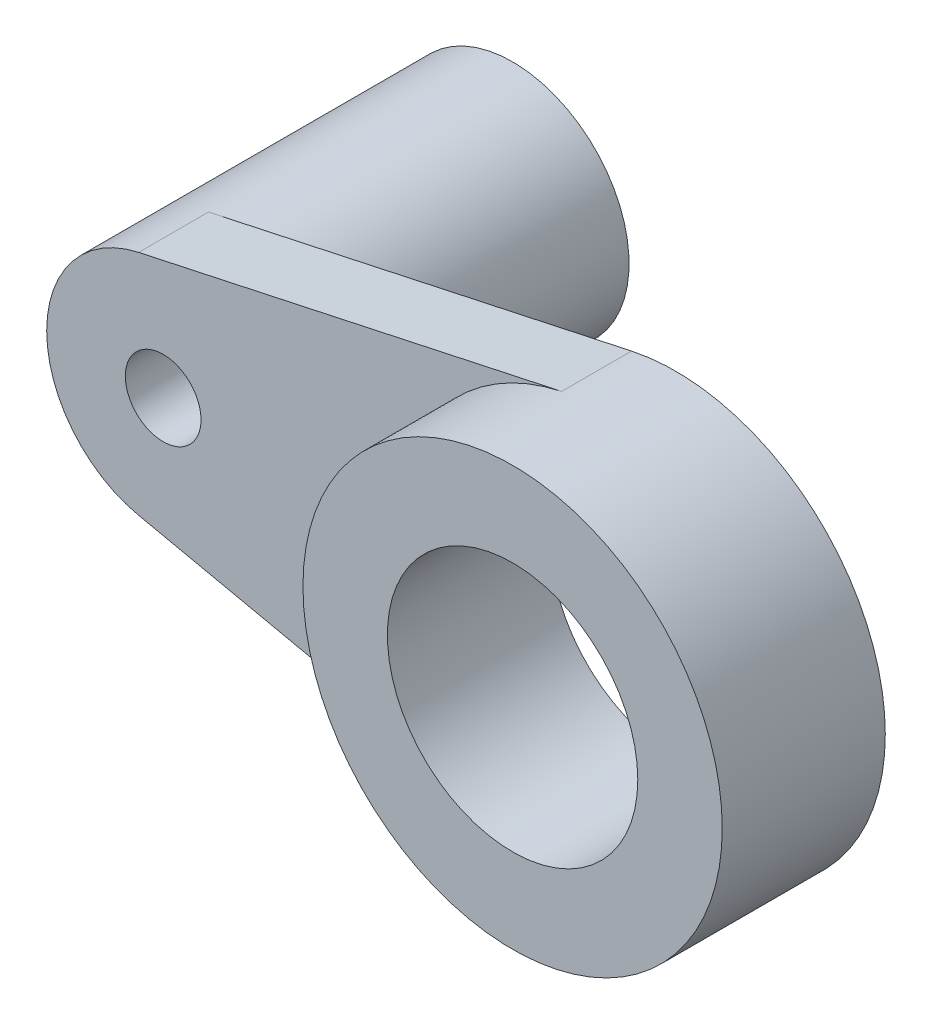
from build123d import *

# Parameters (mm, degrees)
SKETCH1_R           = 18
SKETCH1_R_2         = 10.75
BOSS_EXTRUDE1_DEPTH = 14
SKETCH2_R           = 3.25
BOSS_EXTRUDE2_DEPTH = 6
BOSS_EXTRUDE3_START = 24
SKETCH3_R           = 10
SKETCH3_R_2         = 3.25
BOSS_EXTRUDE3_DEPTH = 24


with BuildPart() as part:
    # Sketch1 → Boss-Extrude1 (new body)
    with BuildSketch(Plane.XY):
        Circle(SKETCH1_R)
        Circle(SKETCH1_R_2, mode=Mode.SUBTRACT)
    extrude(amount=BOSS_EXTRUDE1_DEPTH)

    # Sketch2 → Boss-Extrude2 (add)
    with BuildSketch(Plane(origin=(0, 0, 0), x_dir=(-1, 0, 0), z_dir=(0, 0, -1))):
        with BuildLine():
            ThreePointArc((40.105263158, -9.775881906), (48, 0), (40.105263158, 9.775881906))
            Line((40.105263158, 9.775881906), (3.789473684, 17.59658743))
            ThreePointArc((3.789473684, 17.59658743), (14.003758894, 11.309055524), (18, 0))
            ThreePointArc((18, 0), (14.003758894, -11.309055524), (3.789473684, -17.59658743))
            Line((3.789473684, -17.59658743), (40.105263158, -9.775881906))
        make_face()
        with Locations((38, 0)):
            Circle(SKETCH2_R, mode=Mode.SUBTRACT)
    extrude(amount=-BOSS_EXTRUDE2_DEPTH)

    # Sketch3 → Boss-Extrude3 (add)
    with BuildSketch(Plane(origin=(0, 0, 0), x_dir=(-1, 0, 0), z_dir=(0, 0, -1)).offset(BOSS_EXTRUDE3_START)):
        with Locations((38, 0)):
            Circle(SKETCH3_R)
        with Locations((38, 0)):
            Circle(SKETCH3_R_2, mode=Mode.SUBTRACT)
    extrude(amount=-BOSS_EXTRUDE3_DEPTH)


solid = part.part
